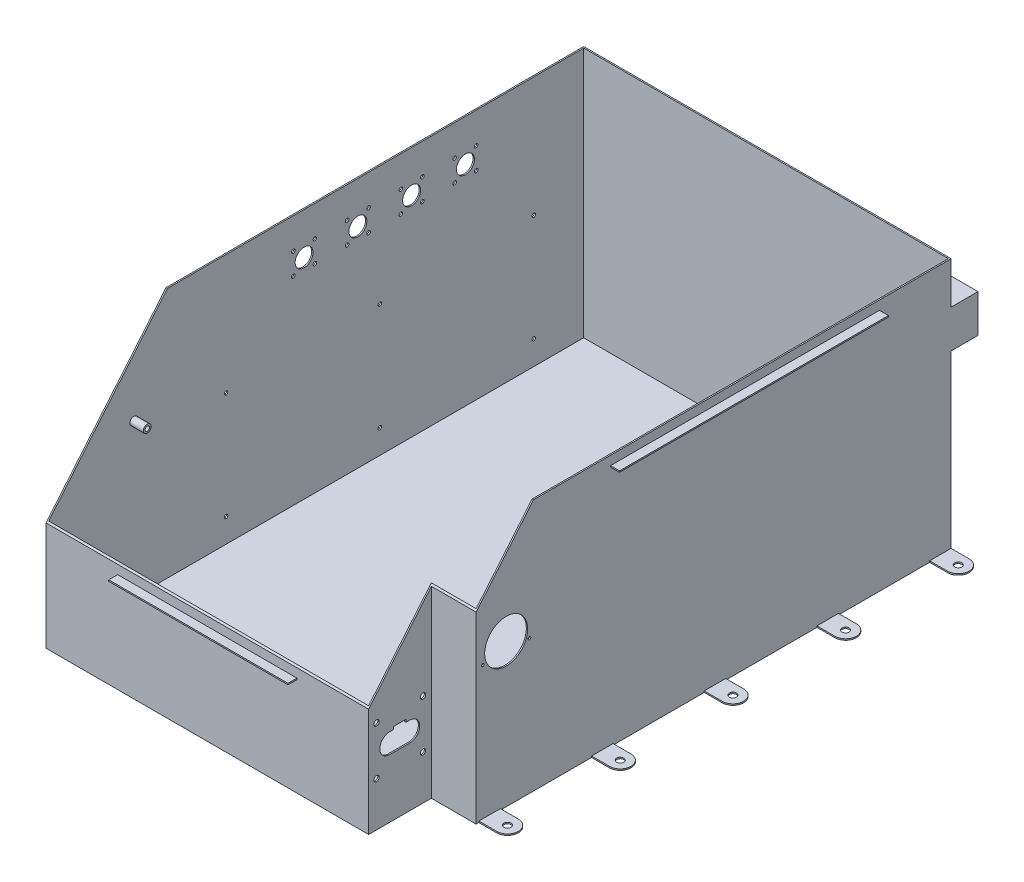
from build123d import *

# Parameters (mm, degrees)
BOSS_EXTRUDE1_DEPTH     = 1.5
BOSS_EXTRUDE2_DEPTH     = 280
SKETCH4_W               = 410
SKETCH4_H               = 42.385541564
BOSS_EXTRUDE3_DEPTH     = 30
CUT_EXTRUDE1_DEPTH      = 616.233320702
CUT_EXTRUDE1_DEPTH_BACK = 616.233320702
SKETCH8_R               = 4.39
SKETCH8_R_2             = 2.39
BOSS_EXTRUDE5_DEPTH     = 15
SKETCH10_R              = 3
CUT_EXTRUDE2_DEPTH      = 1.5
SKETCH15_W              = 15
SKETCH15_H              = 1.5
SKETCH15_W_2            = 20
BOSS_EXTRUDE6_DEPTH     = 13
BOSS_EXTRUDE7_DEPTH     = 1.5
BOSS_EXTRUDE8_DEPTH     = 1.5
SKETCH20_R              = 2.415919743
SKETCH20_R_2            = 2
CUT_EXTRUDE5_DEPTH      = 1.5
SKETCH5_R               = 2
SKETCH5_R_2             = 10
CUT_EXTRUDE7_DEPTH      = 1.5
SKETCH21_W              = 300
SKETCH21_H              = 1.5
BOSS_EXTRUDE9_DEPTH     = 10
SKETCH22_W              = 300
SKETCH22_H              = 1.5
BOSS_EXTRUDE10_DEPTH    = 10
BOSS_EXTRUDE11_DEPTH    = 0.75
BOSS_EXTRUDE12_DEPTH    = 0.75
BOSS_EXTRUDE13_DEPTH    = 0.75
BOSS_EXTRUDE14_DEPTH    = 0.75
SKETCH27_W              = 200
SKETCH27_H              = 1.5
BOSS_EXTRUDE15_DEPTH    = 10
BOSS_EXTRUDE16_DEPTH    = 0.75
BOSS_EXTRUDE17_DEPTH    = 0.75
SKETCH30_R              = 24
SKETCH30_R_2            = 1.5
CUT_EXTRUDE8_DEPTH      = 1.5
SKETCH31_R              = 4
BOSS_EXTRUDE18_DEPTH    = 1.5
BOSS_EXTRUDE18_2_DEPTH  = 1.5
BOSS_EXTRUDE18_3_DEPTH  = 1.5
BOSS_EXTRUDE18_4_DEPTH  = 1.5
BOSS_EXTRUDE18_5_DEPTH  = 1.5
SKETCH33_R              = 2
CUT_EXTRUDE9_DEPTH      = 1.5


with BuildPart() as part:
    # Sketch1 → Boss-Extrude1 (new body)
    with BuildSketch(Plane(origin=(0, 0, 0), x_dir=(1, 0, 0), z_dir=(0, 1, 0))):
        Polygon((-205, 237.826300096), (205, 237.826300096), (205, -292.173699904), (155, -292.173699904), (155, -362.173699904), (-205, -362.173699904), align=None)
    extrude(amount=BOSS_EXTRUDE1_DEPTH)

    # Sketch2 → Boss-Extrude2 (add)
    with BuildSketch(Plane(origin=(0, 1.5, 0), x_dir=(1, 0, 0), z_dir=(0, 1, 0))):
        Polygon((-205, 237.826300096), (-205, -362.173699904), (155, -362.173699904), (155, -292.173699904), (205, -292.173699904), (205, 237.826300096), align=None)
        Polygon((-203.5, 236.326300096), (-203.5, -360.673699904), (153.5, -360.673699904), (153.5, -290.673699904), (203.5, -290.673699904), (203.5, 236.326300096), align=None, mode=Mode.SUBTRACT)
    extrude(amount=BOSS_EXTRUDE2_DEPTH)

    # Sketch4 → Boss-Extrude3 (add)
    with BuildSketch(Plane(origin=(0, 0, -237.826300096), x_dir=(-1, 0, 0), z_dir=(0, 0, -1))):
        with Locations((0, 213.483316708)):
            Rectangle(SKETCH4_W, SKETCH4_H)
    extrude(amount=BOSS_EXTRUDE3_DEPTH)

    # Sketch3 → Cut-Extrude1 (cut, two sides: drawn at the far end of the back side and taken through both)
    with BuildSketch(Plane.ZY.offset(205).offset(-CUT_EXTRUDE1_DEPTH_BACK)):
        Polygon((362.173699904, 121.117558148), (228.195222706, 281.5), (362.173699904, 281.5), align=None)
    extrude(amount=CUT_EXTRUDE1_DEPTH + CUT_EXTRUDE1_DEPTH_BACK, mode=Mode.SUBTRACT)

    # Sketch8 → Boss-Extrude5 (add)
    # profile 1 of 2: a face of its own
    with BuildSketch(Plane(origin=(-203.5, 0, 0), x_dir=(0, 0, -1), z_dir=(1, 0, 0))):
        with Locations((-265.673699904, 172.2)):
            Circle(SKETCH8_R)
        with Locations((-265.673699904, 172.2)):
            Circle(SKETCH8_R_2, mode=Mode.SUBTRACT)
    # profile 2 of 2: a face of its own
    with BuildSketch(Plane(origin=(-203.5, 0, 0), x_dir=(0, 0, -1), z_dir=(1, 0, 0))):
        with Locations((-265.673699904, 16.5)):
            Circle(SKETCH8_R)
        with Locations((-265.673699904, 16.5)):
            Circle(SKETCH8_R_2, mode=Mode.SUBTRACT)
    extrude(amount=BOSS_EXTRUDE5_DEPTH)

    # Sketch10 → Cut-Extrude2 (cut)
    with BuildSketch(Plane.ZY.offset(-153.5)):
        with BuildLine():
            Line((334.423699904, 90.5), (320.423699904, 90.5))
            Line((320.423699904, 90.5), (320.423699904, 87.5))
            Line((320.423699904, 87.5), (316.173699904, 87.5))
            ThreePointArc((316.173699904, 87.5), (305.173699904, 76.5), (316.173699904, 65.5))
            Line((316.173699904, 65.5), (338.673699904, 65.5))
            ThreePointArc((338.673699904, 65.5), (349.673699904, 76.5), (338.673699904, 87.5))
            Line((338.673699904, 87.5), (334.423699904, 87.5))
            Line((334.423699904, 87.5), (334.423699904, 90.5))
        make_face()
        with Locations((301.473699904, 103.45)):
            Circle(SKETCH10_R)
        with Locations((353.373699904, 103.45)):
            Circle(SKETCH10_R)
        with Locations((301.473699904, 49.55)):
            Circle(SKETCH10_R)
        with Locations((353.373699904, 49.55)):
            Circle(SKETCH10_R)
    extrude(amount=-CUT_EXTRUDE2_DEPTH, mode=Mode.SUBTRACT)

    # Sketch15 → Boss-Extrude6 (add)
    with BuildSketch(Plane.ZY.offset(-203.5)):
        with Locations((-143.826300096, 251.386283415)):
            Rectangle(SKETCH15_W, SKETCH15_H)
        with Locations((136.673699904, 251.386283415)):
            Rectangle(SKETCH15_W_2, SKETCH15_H)
    extrude(amount=BOSS_EXTRUDE6_DEPTH)

    # Sketch17 → Boss-Extrude7 (add)
    with BuildSketch(Plane.XY.offset(-136.326300096)):
        Polygon((203.5, 250.636283415), (203.5, 235.636283415), (190.5, 250.636283415), align=None)
    extrude(amount=-BOSS_EXTRUDE7_DEPTH)

    # Sketch18 → Boss-Extrude8 (add)
    with BuildSketch(Plane.XY.offset(126.673699904)):
        Polygon((203.5, 250.636283415), (203.5, 235.636283415), (190.5, 250.636283415), align=None)
    extrude(amount=BOSS_EXTRUDE8_DEPTH)

    # Sketch20 → Cut-Extrude5 (cut)
    with BuildSketch(Plane(origin=(0, 252.136283415, 0), x_dir=(1, 0, 0), z_dir=(0, 1, 0))):
        with Locations(Location((198, 144.326300096, 0), (0, 0, 270))):
            Circle(SKETCH20_R)
        with Locations(Location((200.5, -139.673699904, 0), (0, 0, 270))):
            Circle(SKETCH20_R_2)
    extrude(amount=-CUT_EXTRUDE5_DEPTH, mode=Mode.SUBTRACT)

    # Sketch5 → Cut-Extrude7 (cut)
    with BuildSketch(Plane.ZY.offset(205)):
        with Locations((-116.326300096, 247.125857706)):
            Circle(SKETCH5_R)
        with Locations((-116.326300096, 223.125857706)):
            Circle(SKETCH5_R)
        with Locations((-92.326300096, 223.125857706)):
            Circle(SKETCH5_R)
        with Locations((-92.326300096, 247.125857706)):
            Circle(SKETCH5_R)
        with Locations((-104.326300096, 235.125857706)):
            Circle(SKETCH5_R_2)
        with Locations((-56.326300096, 247.125857706)):
            Circle(SKETCH5_R)
        with Locations((-56.326300096, 223.125857706)):
            Circle(SKETCH5_R)
        with Locations((-32.326300096, 223.125857706)):
            Circle(SKETCH5_R)
        with Locations((-32.326300096, 247.125857706)):
            Circle(SKETCH5_R)
        with Locations((-44.326300096, 235.125857706)):
            Circle(SKETCH5_R_2)
        with Locations((3.673699904, 247.125857706)):
            Circle(SKETCH5_R)
        with Locations((3.673699904, 223.125857706)):
            Circle(SKETCH5_R)
        with Locations((27.673699904, 223.125857706)):
            Circle(SKETCH5_R)
        with Locations((27.673699904, 247.125857706)):
            Circle(SKETCH5_R)
        with Locations((15.673699904, 235.125857706)):
            Circle(SKETCH5_R_2)
        with Locations((63.673699904, 247.125857706)):
            Circle(SKETCH5_R)
        with Locations((63.673699904, 223.125857706)):
            Circle(SKETCH5_R)
        with Locations((87.673699904, 223.125857706)):
            Circle(SKETCH5_R)
        with Locations((87.673699904, 247.125857706)):
            Circle(SKETCH5_R)
        with Locations((75.673699904, 235.125857706)):
            Circle(SKETCH5_R_2)
    extrude(amount=-CUT_EXTRUDE7_DEPTH, mode=Mode.SUBTRACT)

    # Sketch21 → Boss-Extrude9 (add)
    with BuildSketch(Plane(origin=(0, 0, -237.826300096), x_dir=(-1, 0, 0), z_dir=(0, 0, -1))):
        with Locations((0, 270.75)):
            Rectangle(SKETCH21_W, SKETCH21_H)
    extrude(amount=BOSS_EXTRUDE9_DEPTH)

    # Sketch22 → Boss-Extrude10 (add)
    with BuildSketch(Plane.ZY.offset(205)):
        with Locations((-7.826300096, 270.75)):
            Rectangle(SKETCH22_W, SKETCH22_H)
    boss_extrude10 = extrude(amount=BOSS_EXTRUDE10_DEPTH)

    # Sketch23 → Boss-Extrude11 (add, symmetric)
    with BuildSketch(Plane(origin=(0, 0, -77.826300096), x_dir=(-1, 0, 0), z_dir=(0, 0, -1))):
        Polygon((215, 270), (205, 270), (205, 260), align=None)
    boss_extrude11 = extrude(amount=BOSS_EXTRUDE11_DEPTH, both=True)

    # Sketch24 → Boss-Extrude12 (add, symmetric)
    with BuildSketch(Plane.XY.offset(52.173699904)):
        Polygon((-215, 270), (-205, 260), (-205, 270), align=None)
    boss_extrude12 = extrude(amount=BOSS_EXTRUDE12_DEPTH, both=True)

    # Sketch25 → Boss-Extrude13 (add, symmetric)
    with BuildSketch(Plane(origin=(100, 0, 0), x_dir=(0, 0, -1), z_dir=(1, 0, 0))):
        Polygon((247.826300096, 270), (237.826300096, 270), (237.826300096, 260), align=None)
    extrude(amount=BOSS_EXTRUDE13_DEPTH, both=True)

    # Sketch26 → Boss-Extrude14 (add, symmetric)
    with BuildSketch(Plane.ZY.offset(100)):
        Polygon((-247.826300096, 270), (-237.826300096, 260), (-237.826300096, 270), align=None)
    extrude(amount=BOSS_EXTRUDE14_DEPTH, both=True)

    # Mirror1: Boss-Extrude10, Boss-Extrude11, Boss-Extrude12 across plane
    add(boss_extrude10.mirror(Plane(origin=(0, 0, 0), x_dir=(0, 0, 1), z_dir=(1, 0, 0))))
    add(boss_extrude11.mirror(Plane(origin=(0, 0, 0), x_dir=(0, 0, 1), z_dir=(1, 0, 0))))
    add(boss_extrude12.mirror(Plane(origin=(0, 0, 0), x_dir=(0, 0, 1), z_dir=(1, 0, 0))))

    # Sketch27 → Boss-Extrude15 (add)
    with BuildSketch(Plane.XY.offset(362.173699904)):
        with Locations((-25, 110.367558148)):
            Rectangle(SKETCH27_W, SKETCH27_H)
    extrude(amount=BOSS_EXTRUDE15_DEPTH)

    # Sketch28 → Boss-Extrude16 (add, symmetric)
    with BuildSketch(Plane.ZY.offset(95)):
        Polygon((372.173699904, 109.617558148), (362.173699904, 109.617558148), (362.173699904, 99.617558148), align=None)
    extrude(amount=BOSS_EXTRUDE16_DEPTH, both=True)

    # Sketch29 → Boss-Extrude17 (add, symmetric)
    with BuildSketch(Plane(origin=(45, 0, 0), x_dir=(0, 0, -1), z_dir=(1, 0, 0))):
        Polygon((-372.173699904, 109.617558148), (-362.173699904, 99.617558148), (-362.173699904, 109.617558148), align=None)
    extrude(amount=BOSS_EXTRUDE17_DEPTH, both=True)

    # Sketch30 → Cut-Extrude8 (cut)
    with BuildSketch(Plane(origin=(205, 0, 0), x_dir=(0, 0, -1), z_dir=(1, 0, 0))):
        with Locations((-258.673699904, 160)):
            Circle(SKETCH30_R)
        with Locations((-284.673699904, 150)):
            Circle(SKETCH30_R_2)
        with Locations((-232.673699904, 150)):
            Circle(SKETCH30_R_2)
    extrude(amount=-CUT_EXTRUDE8_DEPTH, mode=Mode.SUBTRACT)

    # Sketch33 → Cut-Extrude9 (cut)
    with BuildSketch(Plane.ZY.offset(205)):
        with Locations((-180.626300096, 147.77)):
            Circle(SKETCH33_R)
        with Locations((-180.626300096, 28.39)):
            Circle(SKETCH33_R)
        with Locations((-8.926300096, 147.77)):
            Circle(SKETCH33_R)
        with Locations((-8.926300096, 28.39)):
            Circle(SKETCH33_R)
        with Locations((162.773699904, 147.77)):
            Circle(SKETCH33_R)
        with Locations((162.773699904, 28.39)):
            Circle(SKETCH33_R)
    extrude(amount=-CUT_EXTRUDE9_DEPTH, mode=Mode.SUBTRACT)


with BuildPart() as body_2:
    # Sketch31 → Boss-Extrude18 (new body)
    with BuildSketch(Plane.XZ):
        with BuildLine():
            Line((225, -213.826300096), (205, -213.826300096))
            Line((205, -213.826300096), (205, -237.826300096))
            Line((205, -237.826300096), (225, -237.826300096))
            ThreePointArc((225, -237.826300096), (237, -225.826300096), (225, -213.826300096))
        make_face()
        with Locations(Location((225, -225.826300096, 0), (0, 0, 270))):
            Circle(SKETCH31_R, mode=Mode.SUBTRACT)
    boss_extrude18 = extrude(amount=-BOSS_EXTRUDE18_DEPTH)


with BuildPart() as body_3:
    # Sketch31 → Boss-Extrude18 2 (new body)
    with BuildSketch(Plane.XZ):
        with BuildLine():
            Line((225, -88.076300096), (205, -88.076300096))
            Line((205, -88.076300096), (205, -112.076300096))
            Line((205, -112.076300096), (225, -112.076300096))
            ThreePointArc((225, -112.076300096), (237, -100.076300096), (225, -88.076300096))
        make_face()
        with Locations(Location((225, -100.076300096, 0), (0, 0, 270))):
            Circle(SKETCH31_R, mode=Mode.SUBTRACT)
    boss_extrude18_2 = extrude(amount=-BOSS_EXTRUDE18_2_DEPTH)


with BuildPart() as body_4:
    # Sketch31 → Boss-Extrude18 3 (new body)
    with BuildSketch(Plane.XZ):
        with BuildLine():
            Line((225, 37.673699904), (205, 37.673699904))
            Line((205, 37.673699904), (205, 13.673699904))
            Line((205, 13.673699904), (225, 13.673699904))
            ThreePointArc((225, 13.673699904), (237, 25.673699904), (225, 37.673699904))
        make_face()
        with Locations(Location((225, 25.673699904, 0), (0, 0, 270))):
            Circle(SKETCH31_R, mode=Mode.SUBTRACT)
    boss_extrude18_3 = extrude(amount=-BOSS_EXTRUDE18_3_DEPTH)


with BuildPart() as body_5:
    # Sketch31 → Boss-Extrude18 4 (new body)
    with BuildSketch(Plane.XZ):
        with BuildLine():
            Line((225, 163.423699904), (205, 163.423699904))
            Line((205, 163.423699904), (205, 139.423699904))
            Line((205, 139.423699904), (225, 139.423699904))
            ThreePointArc((225, 139.423699904), (237, 151.423699904), (225, 163.423699904))
        make_face()
        with Locations(Location((225, 151.423699904, 0), (0, 0, 270))):
            Circle(SKETCH31_R, mode=Mode.SUBTRACT)
    boss_extrude18_4 = extrude(amount=-BOSS_EXTRUDE18_4_DEPTH)


with BuildPart() as body_6:
    # Sketch31 → Boss-Extrude18 5 (new body)
    with BuildSketch(Plane.XZ):
        with BuildLine():
            Line((225, 289.173699904), (205, 289.173699904))
            Line((205, 289.173699904), (205, 265.173699904))
            Line((205, 265.173699904), (225, 265.173699904))
            ThreePointArc((225, 265.173699904), (237, 277.173699904), (225, 289.173699904))
        make_face()
        with Locations(Location((225, 277.173699904, 0), (0, 0, 270))):
            Circle(SKETCH31_R, mode=Mode.SUBTRACT)
    boss_extrude18_5 = extrude(amount=-BOSS_EXTRUDE18_5_DEPTH)


with BuildPart() as part_1:
    add(part.part)

    # Mirror2: Boss-Extrude18, Boss-Extrude18 2, Boss-Extrude18 3, Boss-Extrude18 4, Boss-Extrude18 5 across plane
    add(boss_extrude18.mirror(Plane(origin=(0, 0, 0), x_dir=(0, 0, 1), z_dir=(1, 0, 0))))
    add(boss_extrude18_2.mirror(Plane(origin=(0, 0, 0), x_dir=(0, 0, 1), z_dir=(1, 0, 0))))
    add(boss_extrude18_3.mirror(Plane(origin=(0, 0, 0), x_dir=(0, 0, 1), z_dir=(1, 0, 0))))
    add(boss_extrude18_4.mirror(Plane(origin=(0, 0, 0), x_dir=(0, 0, 1), z_dir=(1, 0, 0))))
    add(boss_extrude18_5.mirror(Plane(origin=(0, 0, 0), x_dir=(0, 0, 1), z_dir=(1, 0, 0))))


solid = Compound([body_2.part, body_3.part, body_4.part, body_5.part, body_6.part, part_1.part])
